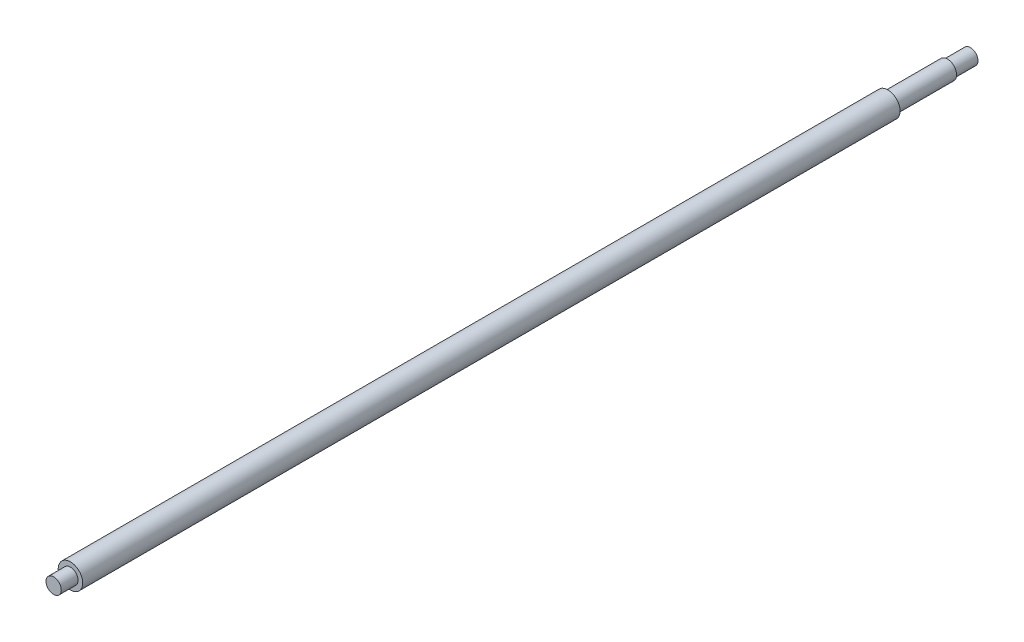
from build123d import *

# Parameters (mm, degrees)
ESQUISSE1_R        = 5
BOSS_EXTRU_1_DEPTH = 15
ESQUISSE2_R        = 6
BOSS_EXTRU_2_DEPTH = 39
ESQUISSE3_R        = 8
BOSS_EXTRU_3_DEPTH = 535
ESQUISSE4_R        = 5
BOSS_EXTRU_4_DEPTH = 11


with BuildPart() as part:
    # Esquisse1 → Boss.-Extru.1 (new body)
    with BuildSketch(Plane.XY):
        Circle(ESQUISSE1_R)
    extrude(amount=BOSS_EXTRU_1_DEPTH)

    # Esquisse2 → Boss.-Extru.2 (add)
    with BuildSketch(Plane.XY.offset(15)):
        Circle(ESQUISSE2_R)
    extrude(amount=BOSS_EXTRU_2_DEPTH)

    # Esquisse3 → Boss.-Extru.3 (add)
    with BuildSketch(Plane.XY.offset(54)):
        Circle(ESQUISSE3_R)
    extrude(amount=BOSS_EXTRU_3_DEPTH)

    # Esquisse4 → Boss.-Extru.4 (add)
    with BuildSketch(Plane.XY.offset(589)):
        Circle(ESQUISSE4_R)
    extrude(amount=BOSS_EXTRU_4_DEPTH)


solid = part.part
